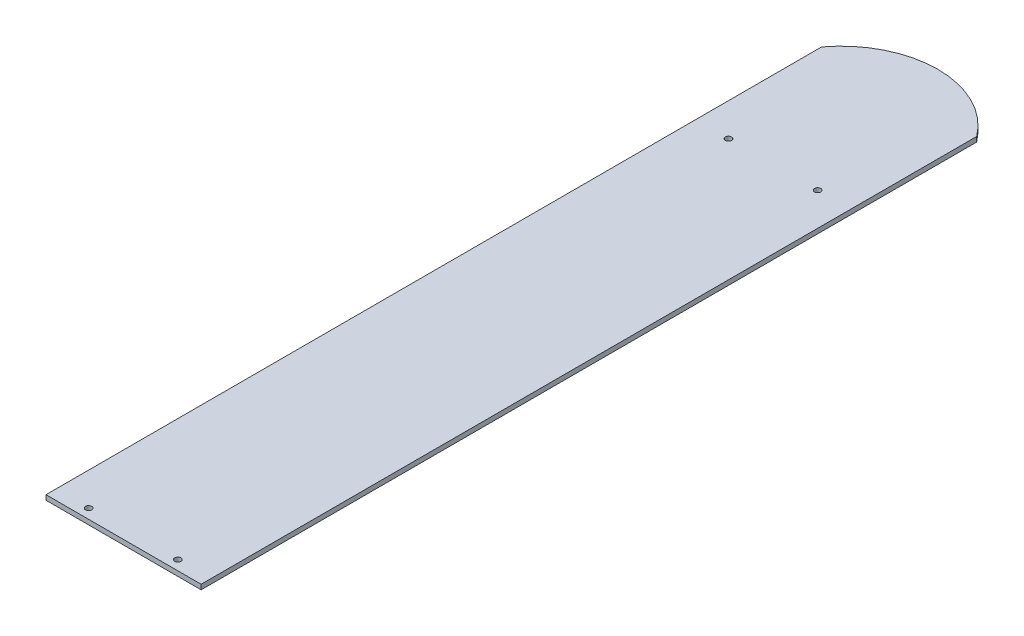
from build123d import *

# Parameters (mm, degrees)
BOSS_EXTRUDE1_DEPTH = 3.175
SKETCH2_R           = 2.032
CUT_EXTRUDE1_DEPTH  = 519.070111689
SCALE1_SCALE        = 0.25


with BuildPart() as part:
    # Sketch1 → Boss-Extrude1 (new body)
    with BuildSketch(Plane(origin=(0, 0, 0), x_dir=(1, 0, 0), z_dir=(0, 1, 0))):
        with BuildLine():
            Line((0, 0), (0, -508))
            Line((0, -508), (101.6, -508))
            Line((101.6, -508), (101.6, 0))
            ThreePointArc((101.6, 0), (50.8, 25.4), (0, 0))
        make_face()
    extrude(amount=BOSS_EXTRUDE1_DEPTH)

    # Sketch2 → Cut-Extrude1 (cut, through all)
    with BuildSketch(Plane.XZ):
        with Locations(Location((21.59, 501.65, 0), (0, 0, 270))):
            Circle(SKETCH2_R)
        with Locations(Location((80.01, 501.65, 0), (0, 0, 270))):
            Circle(SKETCH2_R)
        with Locations(Location((21.59, 82.55, 0), (0, 0, 270))):
            Circle(SKETCH2_R)
        with Locations(Location((80.01, 82.55, 0), (0, 0, 270))):
            Circle(SKETCH2_R)
    extrude(amount=-CUT_EXTRUDE1_DEPTH, mode=Mode.SUBTRACT)


with BuildPart() as part_1:
    # Scale1: scaled about (50.8, 1.5875, 245.02824993)
    add(part.part.scale(SCALE1_SCALE).moved(Location((38.1, 1.190625, 183.771187447))))


solid = part_1.part
